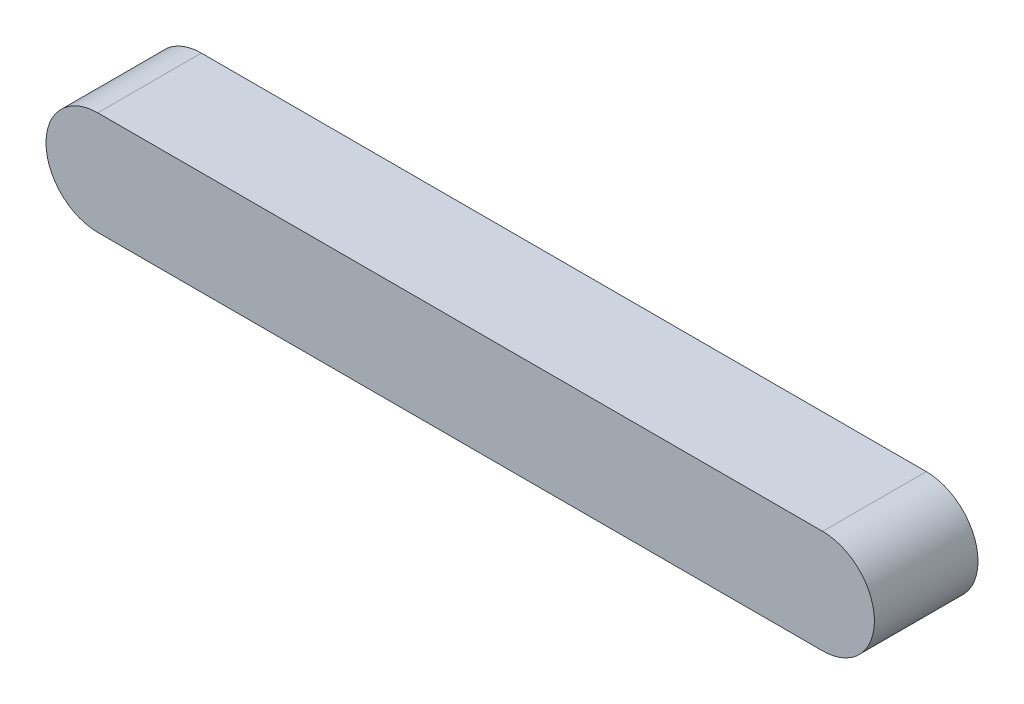
from build123d import *

# Parameters (mm, degrees)
BOSS_EXTRUDE1_DEPTH = 25.4


with BuildPart() as part:
    # Sketch1 → Boss-Extrude1 (new body)
    with BuildSketch(Plane.XY):
        with BuildLine():
            ThreePointArc((0, 25.4), (-12.7, 12.7), (0, 0))
            Line((0, 0), (0, 25.4))
        make_face()
        with BuildLine():
            Line((0, 25.4), (0, 0))
            ThreePointArc((0, 0), (8.980256121, 3.719743879), (12.7, 12.7))
            ThreePointArc((12.7, 12.7), (8.980256121, 21.680256121), (0, 25.4))
        make_face()
        with BuildLine():
            ThreePointArc((12.7, 12.7), (8.980256121, 3.719743879), (0, 0))
            Line((0, 0), (177.8, 0))
            ThreePointArc((177.8, 0), (165.1, 12.7), (177.8, 25.4))
            Line((177.8, 25.4), (0, 25.4))
            ThreePointArc((0, 25.4), (8.980256121, 21.680256121), (12.7, 12.7))
        make_face()
        with BuildLine():
            ThreePointArc((177.8, 25.4), (165.1, 12.7), (177.8, 0))
            Line((177.8, 0), (177.8, 25.4))
        make_face()
        with BuildLine():
            Line((177.8, 25.4), (177.8, 0))
            ThreePointArc((177.8, 0), (186.780256121, 3.719743879), (190.5, 12.7))
            ThreePointArc((190.5, 12.7), (186.780256121, 21.680256121), (177.8, 25.4))
        make_face()
    extrude(amount=BOSS_EXTRUDE1_DEPTH)


solid = part.part
